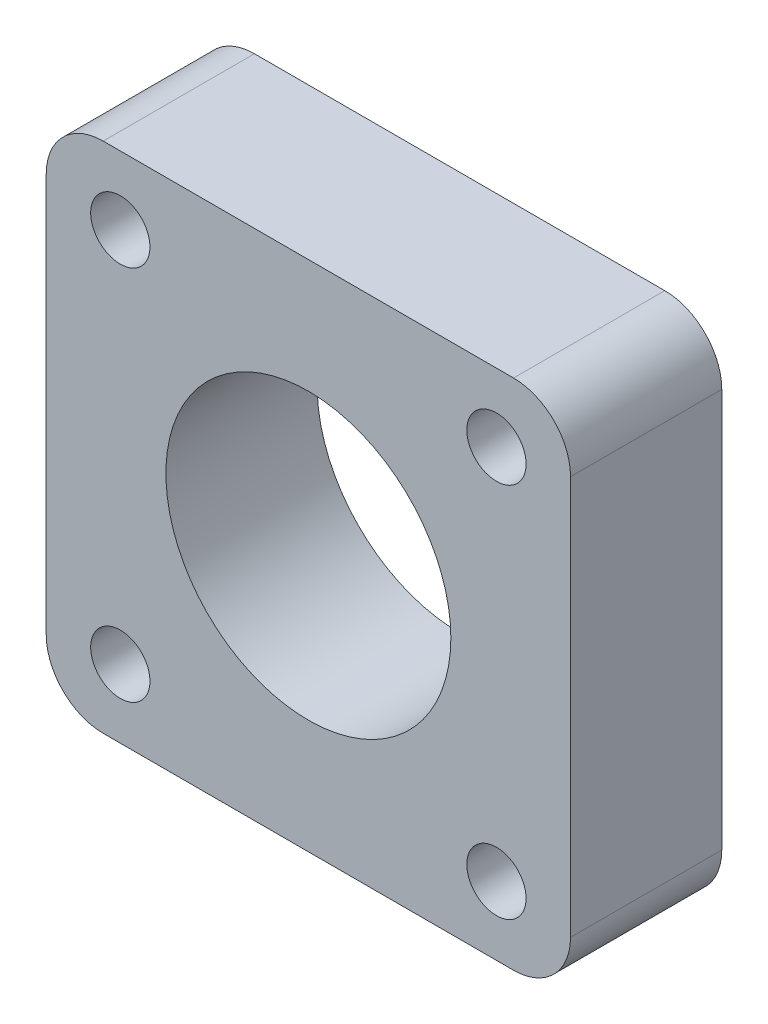
from build123d import *

# Parameters (mm, degrees)
EXTRUDE_1_DEPTH     = 13.268852707
SKETCH_2_R          = 2.6
CUT_EXTRUDE_1_DEPTH = 30
SKETCH_3_R          = 12.5
CUT_EXTRUDE_2_DEPTH = 30


with BuildPart() as part:
    # Эскиз1 → Бобышка-Вытянуть1 (new body)
    with BuildSketch(Plane.XY.offset(36.731147293)):
        with BuildLine():
            Line((114.085323537, 309.675869107), (114.085323537, 274.675869107))
            ThreePointArc((114.085323537, 274.675869107), (115.549789632, 271.140335201), (119.085323537, 269.675869107))
            Line((119.085323537, 269.675869107), (155.085323537, 269.675869107))
            ThreePointArc((155.085323537, 269.675869107), (158.620857443, 271.140335201), (160.085323537, 274.675869107))
            Line((160.085323537, 274.675869107), (160.085323537, 309.675869107))
            ThreePointArc((160.085323537, 309.675869107), (158.620857443, 313.211403013), (155.085323537, 314.675869107))
            Line((155.085323537, 314.675869107), (119.085323537, 314.675869107))
            ThreePointArc((119.085323537, 314.675869107), (115.549789632, 313.211403013), (114.085323537, 309.675869107))
        make_face()
    extrude(amount=EXTRUDE_1_DEPTH)

    # Эскиз2 → Вырез-Вытянуть1 (cut)
    with BuildSketch(Plane.XY.offset(50)):
        with Locations((153.585323537, 308.675869107)):
            Circle(SKETCH_2_R)
        with Locations((120.585323537, 308.675869107)):
            Circle(SKETCH_2_R)
        with Locations((120.585323537, 275.675869107)):
            Circle(SKETCH_2_R)
        with Locations((153.585323537, 275.675869107)):
            Circle(SKETCH_2_R)
    extrude(amount=-CUT_EXTRUDE_1_DEPTH, mode=Mode.SUBTRACT)

    # Эскиз3 → Вырез-Вытянуть2 (cut)
    with BuildSketch(Plane.XY.offset(50)):
        with Locations((137.085323537, 292.175869107)):
            Circle(SKETCH_3_R)
    extrude(amount=-CUT_EXTRUDE_2_DEPTH, mode=Mode.SUBTRACT)


solid = part.part
